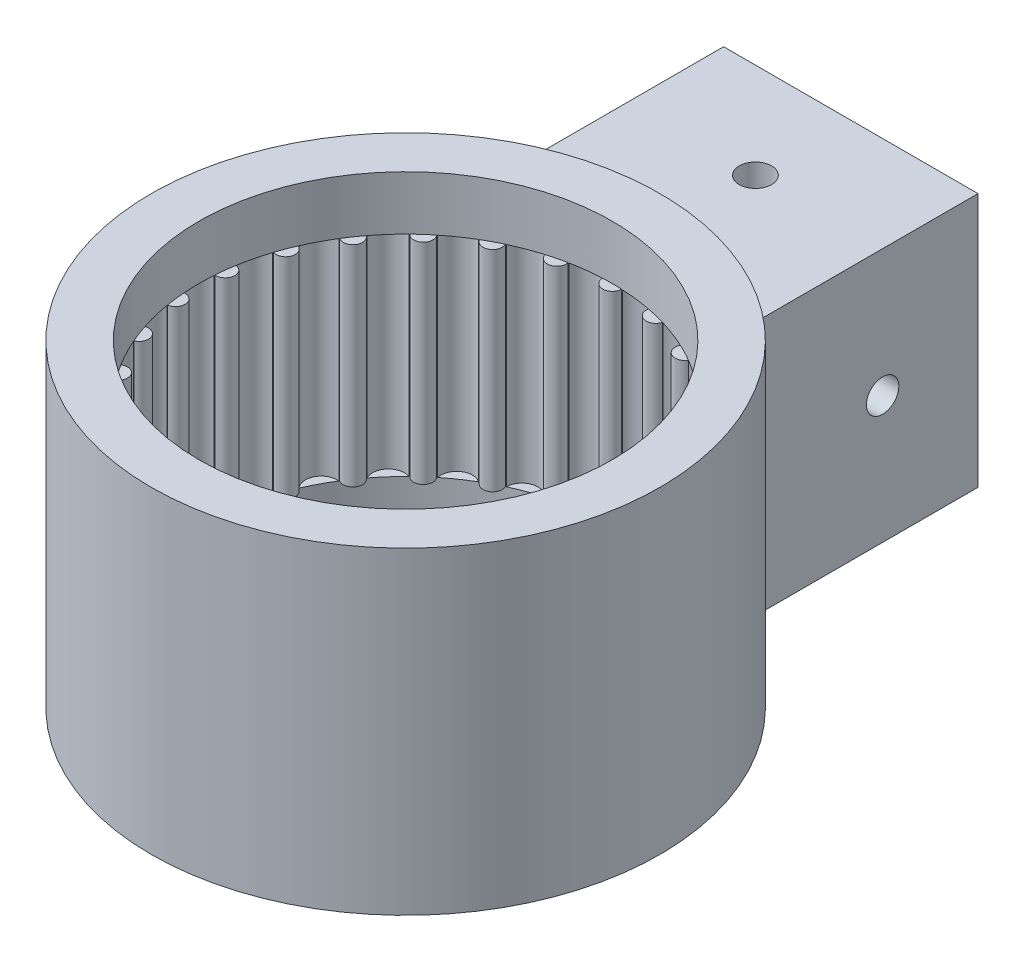
from build123d import *

# Parameters (mm, degrees)
SKETCH1_R                = 40
SKETCH1_R_2              = 32.5
BOSS_EXTRUDE1_DEPTH      = 50
SKETCH2_R                = 1.5
BOSS_EXTRUDE3_DEPTH      = 33
CUT_EXTRUDE1_START       = -33
CUT_EXTRUDE1_DEPTH       = 33
BOSS_EXTRUDE4_REACH      = 129.279
BOSS_EXTRUDE4_END_RADIUS = 40
SKETCH4_W                = 40
SKETCH4_H                = 40
SKETCH4_W_2              = 20.1
SKETCH4_H_2              = 20.1
SKETCH5_R                = 2.55
CUT_EXTRUDE2_DEPTH       = 40
SKETCH6_R                = 2.55
CUT_EXTRUDE3_DEPTH       = 40


with BuildPart() as part:
    # Sketch1 → Boss-Extrude1 (new body)
    with BuildSketch(Plane(origin=(0, 0, 0), x_dir=(1, 0, 0), z_dir=(0, 1, 0))):
        with Locations(Location((0, 0, 0), (0, 0, 270))):
            Circle(SKETCH1_R)
        with Locations(Location((0, 0, 0), (0, 0, 270))):
            Circle(SKETCH1_R_2, mode=Mode.SUBTRACT)
    extrude(amount=BOSS_EXTRUDE1_DEPTH)

    # Sketch2 → Boss-Extrude3 (add)
    with BuildSketch(Plane(origin=(0, 41.5, 0), x_dir=(1, 0, 0), z_dir=(0, 1, 0))):
        with Locations((0, 32.5)):
            Circle(SKETCH2_R)
        with Locations((7.777759089, 31.555609066)):
            Circle(SKETCH2_R)
        with Locations((15.103503091, 28.777320834)):
            Circle(SKETCH2_R)
        with Locations((21.551486393, 24.326599316)):
            Circle(SKETCH2_R)
        with Locations((26.746975642, 18.462104269)):
            Circle(SKETCH2_R)
        with Locations((30.388027887, 11.524658829)):
            Circle(SKETCH2_R)
        with Locations((32.263038408, 3.917442108)):
            Circle(SKETCH2_R)
        with Locations((32.263038408, -3.917442108)):
            Circle(SKETCH2_R)
        with Locations((30.388027887, -11.524658829)):
            Circle(SKETCH2_R)
        with Locations((26.746975642, -18.462104269)):
            Circle(SKETCH2_R)
        with Locations((21.551486393, -24.326599316)):
            Circle(SKETCH2_R)
        with Locations((15.103503091, -28.777320834)):
            Circle(SKETCH2_R)
        with Locations((7.777759089, -31.555609066)):
            Circle(SKETCH2_R)
        with Locations((0, -32.5)):
            Circle(SKETCH2_R)
        with Locations((-7.777759089, -31.555609066)):
            Circle(SKETCH2_R)
        with Locations((-15.103503091, -28.777320834)):
            Circle(SKETCH2_R)
        with Locations((-21.551486393, -24.326599316)):
            Circle(SKETCH2_R)
        with Locations((-26.746975642, -18.462104269)):
            Circle(SKETCH2_R)
        with Locations((-30.388027887, -11.524658829)):
            Circle(SKETCH2_R)
        with Locations((-32.263038408, -3.917442108)):
            Circle(SKETCH2_R)
        with Locations((-32.263038408, 3.917442108)):
            Circle(SKETCH2_R)
        with Locations((-30.388027887, 11.524658829)):
            Circle(SKETCH2_R)
        with Locations((-26.746975642, 18.462104269)):
            Circle(SKETCH2_R)
        with Locations((-21.551486393, 24.326599316)):
            Circle(SKETCH2_R)
        with Locations((-15.103503091, 28.777320834)):
            Circle(SKETCH2_R)
        with Locations((-7.777759089, 31.555609066)):
            Circle(SKETCH2_R)
    extrude(amount=-BOSS_EXTRUDE3_DEPTH)

    # Sketch3 → Cut-Extrude1 (cut)
    with BuildSketch(Plane(origin=(0, 41.5, 0), x_dir=(1, 0, 0), z_dir=(0, 1, 0)).offset(CUT_EXTRUDE1_START)):
        with BuildLine():
            ThreePointArc((20.322874105, 25.361994955), (20.223020326, 26.827476805), (19.314201825, 27.981451139))
            ThreePointArc((19.314201825, 27.981451139), (17.912945255, 28.42200686), (16.507286753, 27.995704743))
            ThreePointArc((16.507286753, 27.995704743), (18.462104269, 26.746975642), (20.322874105, 25.361994955))
        make_face()
        with BuildLine():
            ThreePointArc((13.662805649, 29.488603592), (13.215140677, 30.887604628), (12.056566658, 31.790552062))
            ThreePointArc((12.056566658, 31.790552062), (10.590596171, 31.882963389), (9.327804323, 31.132652738))
            ThreePointArc((9.327804323, 31.132652738), (11.524658829, 30.388027887), (13.662805649, 29.488603592))
        make_face()
        with BuildLine():
            ThreePointArc((6.20870459, 31.901441775), (5.439244922, 33.152657287), (4.098247224, 33.752101708))
            ThreePointArc((4.098247224, 33.752101708), (2.652759937, 33.490997875), (1.606223811, 32.460284119))
            ThreePointArc((1.606223811, 32.460284119), (3.917442108, 32.263038408), (6.20870459, 31.901441775))
        make_face()
        with BuildLine():
            ThreePointArc((-1.606223811, 32.460284119), (-2.652759928, 33.490997871), (-4.098247205, 33.75210171))
            ThreePointArc((-4.098247205, 33.75210171), (-5.439244915, 33.152657294), (-6.20870459, 31.901441775))
            ThreePointArc((-6.20870459, 31.901441775), (-3.917442108, 32.263038408), (-1.606223811, 32.460284119))
        make_face()
        with BuildLine():
            ThreePointArc((-9.327804323, 31.132652738), (-10.590595908, 31.882963326), (-12.056566152, 31.790552254))
            ThreePointArc((-12.056566152, 31.790552254), (-13.215140522, 30.88760485), (-13.662805649, 29.488603592))
            ThreePointArc((-13.662805649, 29.488603592), (-11.524658829, 30.388027887), (-9.327804323, 31.132652738))
        make_face()
        with BuildLine():
            ThreePointArc((-16.507286753, 27.995704743), (-17.912945007, 28.422006861), (-19.314201417, 27.981451421))
            ThreePointArc((-19.314201417, 27.981451421), (-20.223020237, 26.827477036), (-20.322874105, 25.361994955))
            ThreePointArc((-20.322874105, 25.361994955), (-18.462104269, 26.746975642), (-16.507286753, 27.995704743))
        make_face()
        with BuildLine():
            ThreePointArc((-27.626729235, 17.117646795), (-29.069490223, 16.841876642), (-30.10550483, 15.80058793))
            ThreePointArc((-30.10550483, 15.80058793), (-30.373945359, 14.356445145), (-29.78131808, 13.012420736))
            ThreePointArc((-29.78131808, 13.012420736), (-28.777320834, 15.103503091), (-27.626729235, 17.117646795))
        make_face()
        with BuildLine():
            ThreePointArc((-30.920467706, 10.00873003), (-32.255308602, 9.395697919), (-33.012021795, 8.136732577))
            ThreePointArc((-33.012021795, 8.136732577), (-32.927055898, 6.670311983), (-32.030003214, 5.507167519))
            ThreePointArc((-32.030003214, 5.507167519), (-31.555609066, 7.777759089), (-30.920467706, 10.00873003))
        make_face()
        with BuildLine():
            ThreePointArc((-32.417220986, 2.318142257), (-33.566565608, 1.403475461), (-34, 1.2e-07))
            ThreePointArc((-34, 1.2e-07), (-33.566565676, -1.403475363), (-32.417220986, -2.318142257))
            ThreePointArc((-32.417220986, -2.318142257), (-32.5, 0), (-32.417220986, 2.318142257))
        make_face()
        with BuildLine():
            ThreePointArc((-32.030003214, -5.507167519), (-32.927055898, -6.670311983), (-33.012021795, -8.136732577))
            ThreePointArc((-33.012021795, -8.136732577), (-32.255308602, -9.395697919), (-30.920467706, -10.00873003))
            ThreePointArc((-30.920467706, -10.00873003), (-31.555609066, -7.777759089), (-32.030003214, -5.507167519))
        make_face()
        with BuildLine():
            ThreePointArc((-29.78131808, -13.012420736), (-30.373945352, -14.356445086), (-30.105504885, -15.800587826))
            ThreePointArc((-30.105504885, -15.800587826), (-29.069490275, -16.841876614), (-27.626729235, -17.117646795))
            ThreePointArc((-27.626729235, -17.117646795), (-28.777320834, -15.103503091), (-29.78131808, -13.012420736))
        make_face()
        with BuildLine():
            ThreePointArc((25.801850989, 19.761439358), (26.055611476, 21.20823406), (25.449365099, 22.546170763))
            ThreePointArc((25.449365099, 22.546170763), (24.194258568, 23.30926673), (22.727425679, 23.231748148))
            ThreePointArc((22.727425679, 23.231748148), (24.326599316, 21.551486393), (25.801850989, 19.761439358))
        make_face()
        with BuildLine():
            ThreePointArc((29.78131808, 13.012420736), (30.373945388, 14.356445392), (30.105504598, 15.800588372))
            ThreePointArc((30.105504598, 15.800588372), (29.069490003, 16.841876759), (27.626729235, 17.117646795))
            ThreePointArc((27.626729235, 17.117646795), (28.777320834, 15.103503091), (29.78131808, 13.012420736))
        make_face()
        with BuildLine():
            ThreePointArc((32.030003214, 5.507167519), (32.927055522, 6.670310976), (33.012022309, 8.13673049))
            ThreePointArc((33.012022309, 8.13673049), (32.255309403, 9.395697202), (30.920467706, 10.00873003))
            ThreePointArc((30.920467706, 10.00873003), (31.555609066, 7.777759089), (32.030003214, 5.507167519))
        make_face()
        with BuildLine():
            ThreePointArc((32.417220986, -2.318142257), (33.566565642, -1.403475412), (34, 0))
            ThreePointArc((34, 0), (33.566565642, 1.403475412), (32.417220986, 2.318142257))
            ThreePointArc((32.417220986, 2.318142257), (32.479298654, 1.159809886), (32.5, 0))
            ThreePointArc((32.5, 0), (32.479298654, -1.159809886), (32.417220986, -2.318142257))
        make_face()
        with BuildLine():
            ThreePointArc((30.920467706, -10.00873003), (32.255309555, -9.395697066), (33.012022407, -8.136730094))
            ThreePointArc((33.012022407, -8.136730094), (32.927055451, -6.670310785), (32.030003214, -5.507167519))
            ThreePointArc((32.030003214, -5.507167519), (31.555609066, -7.777759089), (30.920467706, -10.00873003))
        make_face()
        with BuildLine():
            ThreePointArc((27.626729235, -17.117646795), (29.069489086, -16.841877246), (30.105503634, -15.80059021))
            ThreePointArc((30.105503634, -15.80059021), (30.373945508, -14.356446423), (29.78131808, -13.012420736))
            ThreePointArc((29.78131808, -13.012420736), (28.777320834, -15.103503091), (27.626729235, -17.117646795))
        make_face()
        with BuildLine():
            ThreePointArc((22.727425679, -23.231748148), (24.194258809, -23.309266669), (25.449365428, -22.546170391))
            ThreePointArc((25.449365428, -22.546170391), (26.055611507, -21.208233813), (25.801850989, -19.761439358))
            ThreePointArc((25.801850989, -19.761439358), (24.326599316, -21.551486393), (22.727425679, -23.231748148))
        make_face()
        with BuildLine():
            ThreePointArc((16.507286753, -27.995704743), (17.912946283, -28.422006855), (19.314203518, -27.981449971))
            ThreePointArc((19.314203518, -27.981449971), (20.223020695, -26.827475845), (20.322874105, -25.361994955))
            ThreePointArc((20.322874105, -25.361994955), (18.462104269, -26.746975642), (16.507286753, -27.995704743))
        make_face()
        with BuildLine():
            ThreePointArc((9.327804323, -31.132652738), (10.590597093, -31.882963611), (12.056568433, -31.790551389))
            ThreePointArc((12.056568433, -31.790551389), (13.21514122, -30.88760385), (13.662805649, -29.488603592))
            ThreePointArc((13.662805649, -29.488603592), (11.524658829, -30.388027887), (9.327804323, -31.132652738))
        make_face()
        with BuildLine():
            ThreePointArc((1.606223811, -32.460284119), (2.652760867, -33.490998357), (4.098249305, -33.752101455))
            ThreePointArc((4.098249305, -33.752101455), (5.43924571, -33.152656596), (6.20870459, -31.901441775))
            ThreePointArc((6.20870459, -31.901441775), (3.917442108, -32.263038408), (1.606223811, -32.460284119))
        make_face()
        with BuildLine():
            ThreePointArc((-6.20870459, -31.901441775), (-5.439244203, -33.152657918), (-4.098245324, -33.752101938))
            ThreePointArc((-4.098245324, -33.752101938), (-2.652759087, -33.490997435), (-1.606223811, -32.460284119))
            ThreePointArc((-1.606223811, -32.460284119), (-3.917442108, -32.263038408), (-6.20870459, -31.901441775))
        make_face()
        with BuildLine():
            ThreePointArc((-13.662805649, -29.488603592), (-13.215140137, -30.887605401), (-12.056564895, -31.790552731))
            ThreePointArc((-12.056564895, -31.790552731), (-10.590595254, -31.882963168), (-9.327804323, -31.132652738))
            ThreePointArc((-9.327804323, -31.132652738), (-11.524658829, -30.388027887), (-13.662805649, -29.488603592))
        make_face()
        with BuildLine():
            ThreePointArc((-20.322874105, -25.361994955), (-20.223020168, -26.827477213), (-19.314201105, -27.981451636))
            ThreePointArc((-19.314201105, -27.981451636), (-17.912944818, -28.422006862), (-16.507286753, -27.995704743))
            ThreePointArc((-16.507286753, -27.995704743), (-18.462104269, -26.746975642), (-20.322874105, -25.361994955))
        make_face()
        with BuildLine():
            ThreePointArc((-25.801850989, -19.761439358), (-26.05561151, -21.208233791), (-25.449365458, -22.546170358))
            ThreePointArc((-25.449365458, -22.546170358), (-24.194258831, -23.309266664), (-22.727425679, -23.231748148))
            ThreePointArc((-22.727425679, -23.231748148), (-24.326599316, -21.551486393), (-25.801850989, -19.761439358))
        make_face()
        with BuildLine():
            ThreePointArc((-22.727425679, 23.231748148), (-24.194258782, 23.309266676), (-25.449365391, 22.546170433))
            ThreePointArc((-25.449365391, 22.546170433), (-26.055611504, 21.208233841), (-25.801850989, 19.761439358))
            ThreePointArc((-25.801850989, 19.761439358), (-24.326599316, 21.551486393), (-22.727425679, 23.231748148))
        make_face()
    extrude(amount=CUT_EXTRUDE1_DEPTH, mode=Mode.SUBTRACT)

    # Boss-Extrude4: up to this cylinder (the profile starts outside it)
    boss_extrude4_end = Plane(origin=(0, 44.434315, 0), z_dir=(0, -1, 0)) * Cylinder(BOSS_EXTRUDE4_END_RADIUS, 339.558, mode=Mode.PRIVATE)
    # Sketch4 → Boss-Extrude4 (add, up to the surface)
    with BuildSketch(Plane.XY.offset(-70), mode=Mode.PRIVATE) as boss_extrude4_sk1:
        with Locations((0, 25)):
            Rectangle(SKETCH4_W, SKETCH4_H)
        with Locations((0, 25)):
            Rectangle(SKETCH4_W_2, SKETCH4_H_2, mode=Mode.SUBTRACT)
    boss_extrude4_tool1 = extrude(boss_extrude4_sk1.sketch, amount=BOSS_EXTRUDE4_REACH, mode=Mode.PRIVATE) - boss_extrude4_end
    add(boss_extrude4_tool1.solids().sort_by_distance((0, 44.434315, -70))[0])

    # Sketch5 → Cut-Extrude2 (cut)
    with BuildSketch(Plane(origin=(0, 45, 0), x_dir=(1, 0, 0), z_dir=(0, 1, 0))):
        with Locations(Location((0, 55, 0), (0, 0, 180))):
            Circle(SKETCH5_R)
    extrude(amount=-CUT_EXTRUDE2_DEPTH, mode=Mode.SUBTRACT)

    # Sketch6 → Cut-Extrude3 (cut)
    with BuildSketch(Plane.ZY.offset(20)):
        with Locations((-55, 25)):
            Circle(SKETCH6_R)
    extrude(amount=-CUT_EXTRUDE3_DEPTH, mode=Mode.SUBTRACT)


solid = part.part
